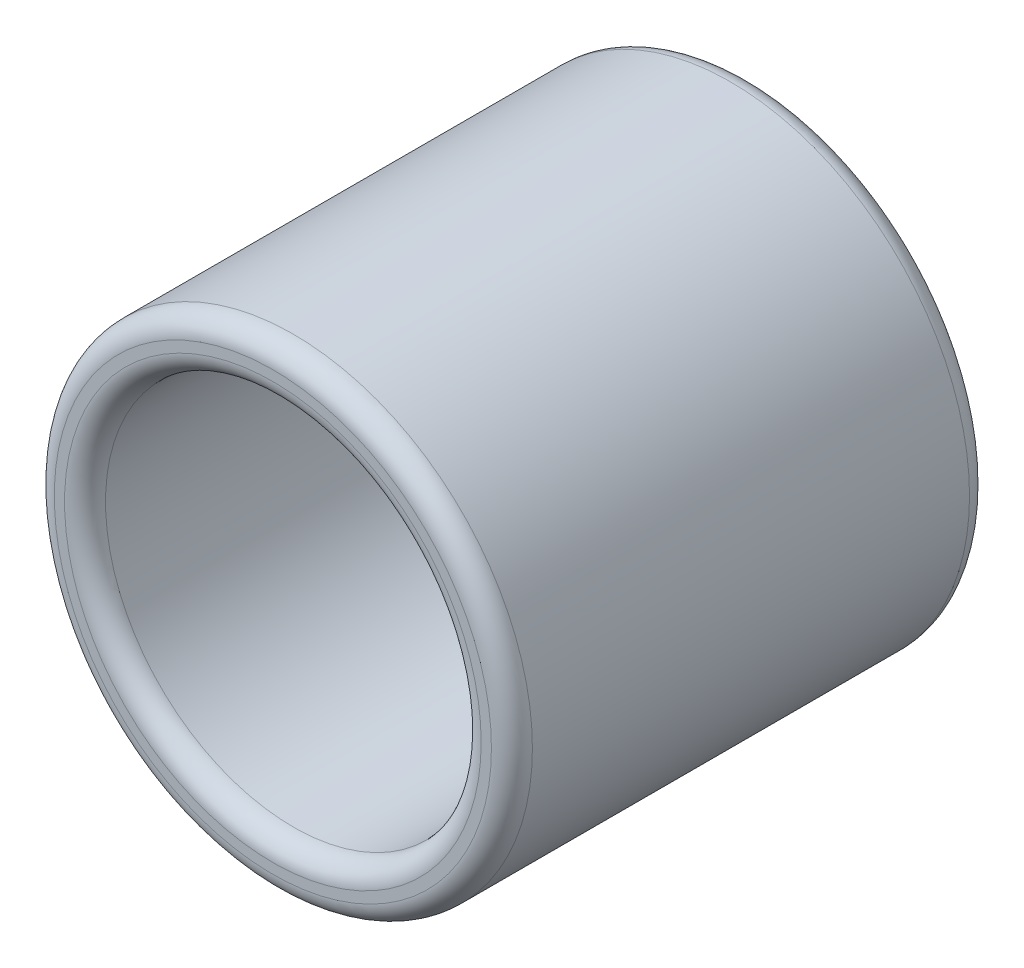
from build123d import *

# Parameters (mm, degrees)
SKETCH1_R           = 3.5
BOSS_EXTRUDE1_DEPTH = 7
SKETCH2_R           = 2.75
CUT_EXTRUDE1_DEPTH  = 7
FILLET2_R           = 0.3
FILLET3_R           = 0.3


with BuildPart() as part:
    # Sketch1 → Boss-Extrude1 (new body)
    with BuildSketch(Plane.XY):
        Circle(SKETCH1_R)
    extrude(amount=BOSS_EXTRUDE1_DEPTH)

    # Sketch2 → Cut-Extrude1 (cut)
    with BuildSketch(Plane(origin=(0, 0, 0), x_dir=(-1, 0, 0), z_dir=(0, 0, -1))):
        Circle(SKETCH2_R)
    extrude(amount=-CUT_EXTRUDE1_DEPTH, mode=Mode.SUBTRACT)

    # Fillet2
    fillet2_edges = [part.edges().sort_by_distance(p)[0] for p in [
        (-3.5, 0, 0),
        (2.75, 0, 7),
        (2.75, 0, 0),
    ]]
    fillet(fillet2_edges, radius=FILLET2_R)

    # Fillet3
    fillet3_edges = [part.edges().sort_by_distance(p)[0] for p in [
        (-3.5, 0, 7),
    ]]
    fillet(fillet3_edges, radius=FILLET3_R)


solid = part.part
